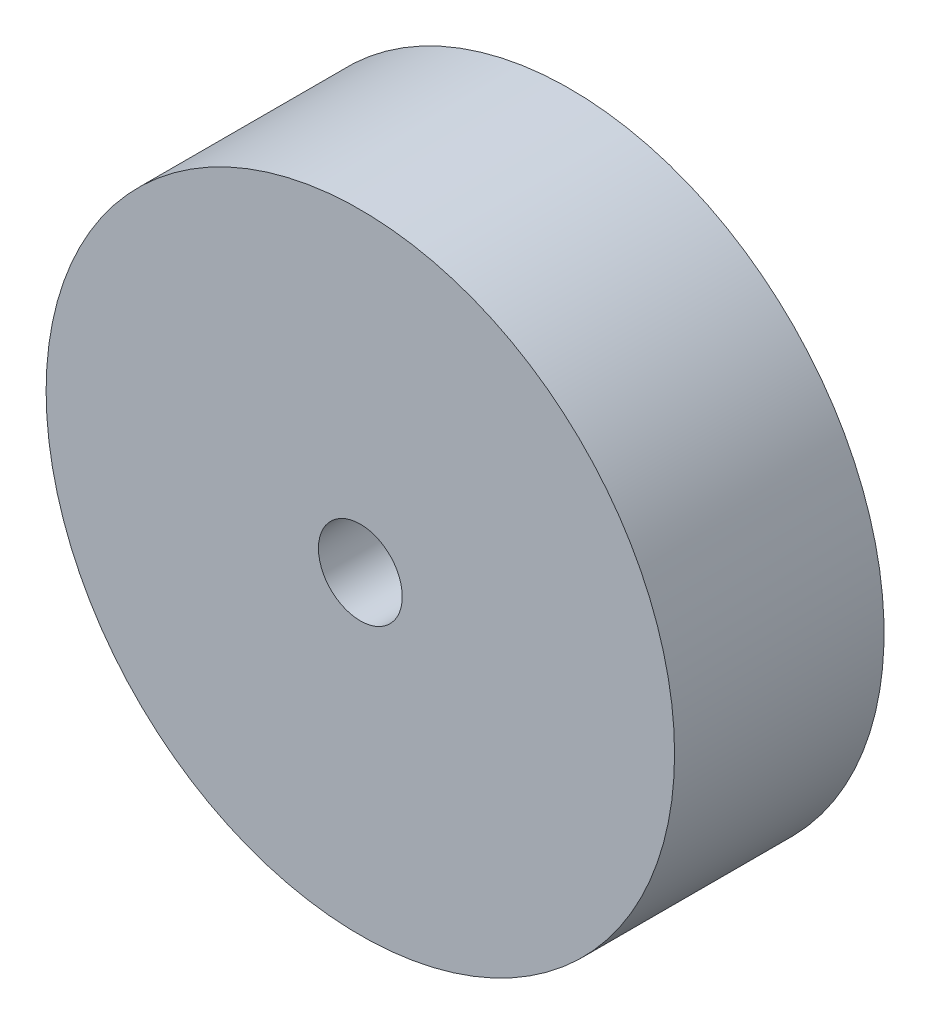
from build123d import *
from build123d.topology import SkipClean

# Parameters (mm, degrees)
SKETCH_1_R               = 30
EXTRUDE_1_DEPTH          = 10
EXTRUDE_START            = 10
EXTRUDE_2_DEPTH          = 10
EXTRUDE_3_DEPTH          = 10
SKETCH_4_W               = 51
SKETCH_4_H               = 20.2
CUT_EXTRUDE_1_DEPTH      = 22
CUT_EXTRUDE_2_DEPTH      = 38
CUT_EXTRUDE_2_DEPTH_BACK = 29
SKETCH_5_R               = 1.45
SKETCH_8_R               = 4
CUT_EXTRUDE_5_DEPTH      = 57


with BuildPart() as part:
    # 草图1 → 凸台-拉伸1 (new body)
    with BuildSketch(Plane.XY):
        with Locations((0, -10)):
            Circle(SKETCH_1_R)
    extrude(amount=EXTRUDE_1_DEPTH)

    # 草图2 → 凸台-拉伸2 (add)
    with BuildSketch(Plane(origin=(0, 0, 0), x_dir=(-1, 0, 0), z_dir=(0, 0, -1)).offset(EXTRUDE_START)):
        with BuildLine():
            Line((28.284271247, 0), (-28.284271247, 0))
            ThreePointArc((-28.284271247, 0), (0, 20), (28.284271247, 0))
        make_face()
        with BuildLine():
            Line((28.284271247, -20), (-28.284271247, -20))
            ThreePointArc((-28.284271247, -20), (0, -40), (28.284271247, -20))
        make_face()
    extrude(amount=-EXTRUDE_2_DEPTH)

    # 草图3 → 凸台-拉伸3 (add)
    with SkipClean():  # the faces are left unmerged after this step: merging them gives an invalid solid
        with BuildSketch(Plane(origin=(0, 0, -10), x_dir=(-1, 0, 0), z_dir=(0, 0, -1))):
            with BuildLine():
                Line((-28.284271247, -20), (-25, -20))
                Line((-25, -20), (-25, 0))
                Line((-25, 0), (-28.284271247, 0))
                ThreePointArc((-28.284271247, 0), (-30, -10), (-28.284271247, -20))
            make_face()
            with BuildLine():
                Line((28.284271247, 0), (25, 0))
                Line((25, 0), (25, -20))
                Line((25, -20), (28.284271247, -20))
                ThreePointArc((28.284271247, -20), (29.56795679, -15.073059362), (30, -10))
                ThreePointArc((30, -10), (29.56795679, -4.926940638), (28.284271247, 0))
            make_face()
        extrude(amount=-EXTRUDE_3_DEPTH)

    # 草图4 → 切除-拉伸1 (cut)
    with SkipClean():  # the faces are left unmerged after this step: merging them gives an invalid solid
        with BuildSketch(Plane(origin=(0, 0, 0), x_dir=(-1, 0, 0), z_dir=(0, 0, -1))):
            with Locations((0, -10)):
                Rectangle(SKETCH_4_W, SKETCH_4_H)
        extrude(amount=CUT_EXTRUDE_1_DEPTH, mode=Mode.SUBTRACT)

    # 草图5 → 切除-拉伸2 (cut, two sides: drawn at the far end of the back side and taken through both)
    with SkipClean():  # the faces are left unmerged after this step: merging them gives an invalid solid
        with BuildSketch(Plane(origin=(0, -20.1, 0), x_dir=(1, 0, 0), z_dir=(0, 1, 0)).offset(-CUT_EXTRUDE_2_DEPTH_BACK)):
            with Locations(Location((0, 3, 0), (0, 0, 90))):
                Circle(SKETCH_5_R)
        extrude(amount=CUT_EXTRUDE_2_DEPTH + CUT_EXTRUDE_2_DEPTH_BACK, mode=Mode.SUBTRACT)

    # 草图8 → 切除-拉伸5 (cut)
    with SkipClean():  # the faces are left unmerged after this step: merging them gives an invalid solid
        with BuildSketch(Plane(origin=(0, 0, 0), x_dir=(-1, 0, 0), z_dir=(0, 0, -1))):
            with Locations((0, -10)):
                Circle(SKETCH_8_R)
        extrude(amount=-CUT_EXTRUDE_5_DEPTH, mode=Mode.SUBTRACT)


solid = part.part
